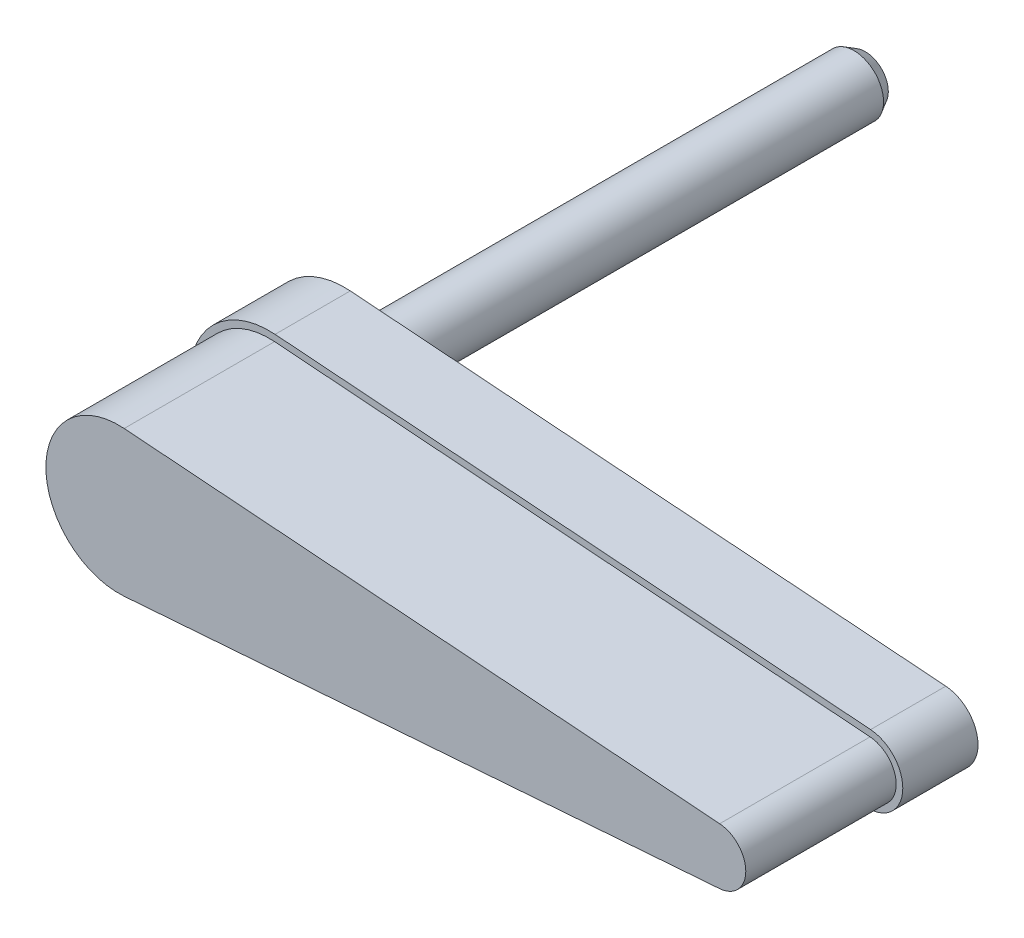
from build123d import *

# Parameters (mm, degrees)
SALIENTE_EXTRUIR1_DEPTH = 24
SALIENTE_EXTRUIR2_DEPTH = 8
CROQUIS3_R              = 3.15
SALIENTE_EXTRUIR3_DEPTH = 55.4
CHAFL_N1_SIZE           = 1.2
CHAFL_N1_SIZE2          = 0.692820323


with BuildPart() as part:
    # Croquis1 → Saliente-Extruir1 (new body)
    with BuildSketch(Plane.XY):
        with BuildLine():
            Line((63.919718915, 2.991646678), (0.57794053, 7.728420585))
            ThreePointArc((0.57794053, 7.728420585), (-7.75, 0), (0.57794053, -7.728420585))
            Line((0.57794053, -7.728420585), (63.919718915, -2.991646678))
            ThreePointArc((63.919718915, -2.991646678), (66.696, 0), (63.919718915, 2.991646678))
        make_face()
    extrude(amount=SALIENTE_EXTRUIR1_DEPTH)

    # Croquis2 → Saliente-Extruir2 (add)
    with BuildSketch(Plane.XY):
        with BuildLine():
            Line((0.63014161, -8.426471477), (63.971919995, -3.68969757))
            ThreePointArc((63.971919995, -3.68969757), (67.396, 0), (63.971919995, 3.68969757))
            Line((63.971919995, 3.68969757), (0.63014161, 8.426471477))
            ThreePointArc((0.63014161, 8.426471477), (-8.45, 0), (0.63014161, -8.426471477))
        make_face()
        with BuildLine():
            Line((63.919718915, 2.991646678), (0.57794053, 7.728420585))
            ThreePointArc((0.57794053, 7.728420585), (-7.75, 0), (0.57794053, -7.728420585))
            Line((0.57794053, -7.728420585), (63.919718915, -2.991646678))
            ThreePointArc((63.919718915, -2.991646678), (66.696, 0), (63.919718915, 2.991646678))
        make_face(mode=Mode.SUBTRACT)
    extrude(amount=SALIENTE_EXTRUIR2_DEPTH)

    # Croquis3 → Saliente-Extruir3 (add)
    with BuildSketch(Plane(origin=(0, 0, 0), x_dir=(-1, 0, 0), z_dir=(0, 0, -1))):
        Circle(CROQUIS3_R)
    extrude(amount=SALIENTE_EXTRUIR3_DEPTH)

    # Chaflán1
    chafl_n1_edges = [part.edges().sort_by_distance(p)[0] for p in [
        (3.15, 0, -55.4),
    ]]
    chafl_n1_side = [part.faces().sort_by_distance(p)[0] for p in [
        (3.15, 0, -27.7),
    ]]
    chamfer(chafl_n1_edges, length=CHAFL_N1_SIZE, length2=CHAFL_N1_SIZE2, reference=chafl_n1_side[0])


solid = part.part
